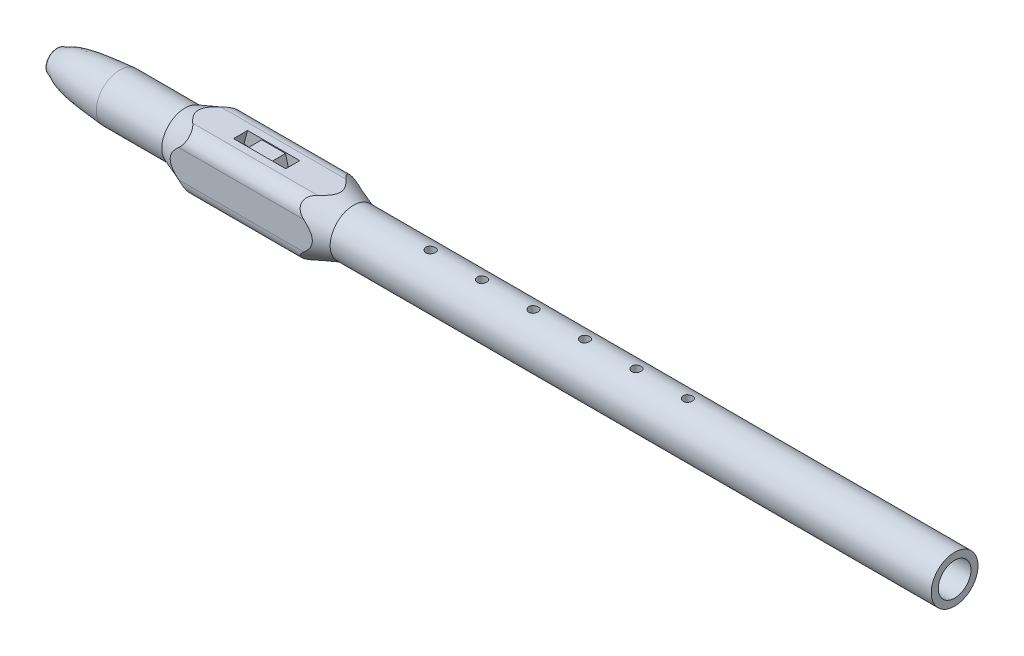
from build123d import *

# Parameters (mm, degrees)
SKETCH1_W           = 38.1
SKETCH1_H           = 38.1
BOSS_EXTRUDE1_DEPTH = 304.8
SKETCH2_W           = 457.2
SKETCH2_H           = 11.1125
SKETCH4_R           = 3.175
CUT_EXTRUDE1_DEPTH  = 50.8
FILLET1_R           = 1.27
SKETCH5_R           = 3.175
CUT_EXTRUDE2_DEPTH  = 306.988308712
CUT_EXTRUDE4_DEPTH  = 4.7625
SKETCH8_W           = 19.528086639
SKETCH8_H           = 9.525
CUT_EXTRUDE5_DEPTH  = 0.635
FILLET2_R           = 9.525


with BuildPart() as part:
    # Sketch1 → Boss-Extrude1 (new, symmetric)
    with BuildSketch(Plane(origin=(0, 0, 0), x_dir=(0, 0, -1), z_dir=(1, 0, 0))):
        Rectangle(SKETCH1_W, SKETCH1_H)
    extrude(amount=BOSS_EXTRUDE1_DEPTH, both=True)

    # Sketch2 → Cut-Revolve1 (revolve, cut)
    with BuildSketch(Plane(origin=(0, 0, 0), x_dir=(1, 0, 0), z_dir=(0, 1, 0))):
        with Locations((76.2, -5.55625)):
            Rectangle(SKETCH2_W, SKETCH2_H)
        with BuildLine():
            Line((-171.45, 0), (-273.05, 0))
            ThreePointArc((-273.05, 0), (-269.795224106, -7.857724106), (-261.9375, -11.1125))
            Line((-261.9375, -11.1125), (-182.5625, -11.1125))
            ThreePointArc((-182.5625, -11.1125), (-174.704775894, -7.857724106), (-171.45, 0))
        make_face()
    revolve(axis=Axis((-304.8, 0, 0), (1, 0, 0)), mode=Mode.SUBTRACT)

    # Sketch3 → Cut-Revolve2 (revolve, cut)
    with BuildSketch(Plane.XY, mode=Mode.PRIVATE) as cut_revolve2_sk:
        with BuildLine():
            Line((304.8, 19.05), (304.8, 15.875))
            Line((304.8, 15.875), (-103.1875, 15.875))
            add(Edge.make_bspline(
                [(-103.1875, 15.875), (-131.457422614, 25.417723514), (-160.3375, 42.016250259)],
                knots=[0, 0, 0, 0.605944762, 0.605944762, 0.605944762], degree=2))
            add(Edge.make_bspline(
                [(-217.4875, 15.875), (-189.217577386, 25.417723514), (-160.3375, 42.016250259)],
                knots=[0, 0, 0, 0.605944762, 0.605944762, 0.605944762], degree=2))
            Line((-217.4875, 15.875), (-261.9375, 15.875))
            add(Edge.make_bspline(
                [(-261.9375, 15.875), (-299.478479185, 13.267926709), (-300.391996549, 9.252287069), (-299.320045063, 8.700258168), (-304.8, 7.62)],
                knots=[0, 0, 0, 0, 0, 1, 1, 1, 1, 1], degree=4))
            Line((-304.8, 7.62), (-304.8, 19.05))
            Line((-304.8, 19.05), (-304.8, 56.377941574))
            Line((-304.8, 56.377941574), (304.8, 56.377941574))
            Line((304.8, 56.377941574), (304.8, 19.05))
        make_face()
    revolve(cut_revolve2_sk.sketch.rotate(Axis((-304.8, 0, 0), (1, 0, 0)), 180), axis=Axis((-304.8, 0, 0), (1, 0, 0)), mode=Mode.SUBTRACT)

    # Sketch4 → Cut-Extrude1 (cut)
    with BuildSketch(Plane.ZY.offset(304.8)):
        Circle(SKETCH4_R)
    extrude(amount=-CUT_EXTRUDE1_DEPTH, mode=Mode.SUBTRACT)

    # Fillet1
    fillet1_edges = [part.edges().sort_by_distance(p)[0] for p in [
        (-304.8, 7.62, 0),
    ]]
    fillet(fillet1_edges, radius=FILLET1_R)

    # Sketch5 → Cut-Extrude2 (cut, through all)
    with BuildSketch(Plane(origin=(0, 0, 0), x_dir=(1, 0, 0), z_dir=(0, 1, 0))):
        with Locations(Location((-50.8, 0, 0), (0, 0, 90))):
            Circle(SKETCH5_R)
        with Locations(Location((-15.875, 0, 0), (0, 0, 90))):
            Circle(SKETCH5_R)
        with Locations(Location((19.05, 0, 0), (0, 0, 90))):
            Circle(SKETCH5_R)
        with Locations(Location((53.975, 0, 0), (0, 0, 90))):
            Circle(SKETCH5_R)
        with Locations(Location((88.9, 0, 0), (0, 0, 90))):
            Circle(SKETCH5_R)
        with Locations(Location((123.825, 0, 0), (0, 0, 90))):
            Circle(SKETCH5_R)
    extrude(amount=CUT_EXTRUDE2_DEPTH, mode=Mode.SUBTRACT)

    # Sketch7 → Cut-Extrude4 (cut, symmetric)
    with BuildSketch(Plane.XY):
        Polygon((-177.77754171, 26.86882557), (-184.427590717, 2.050504802), (-175.227147222, -0.414746603), (-168.577098214, 24.403574166), align=None)
        Polygon((-146.514298715, 26.86882557), (-155.714742211, 24.403574166), (-149.064693203, -0.414746603), (-139.864249708, 2.050504802), align=None)
    extrude(amount=CUT_EXTRUDE4_DEPTH, both=True, mode=Mode.SUBTRACT)

    # Sketch8 → Cut-Extrude5 (cut)
    with BuildSketch(Plane(origin=(0, 19.05, 0), x_dir=(1, 0, 0), z_dir=(0, 1, 0))):
        with Locations((-162.961998978, 0)):
            Rectangle(SKETCH8_W, SKETCH8_H)
    extrude(amount=-CUT_EXTRUDE5_DEPTH, mode=Mode.SUBTRACT)

    # Fillet2
    fillet2_edges = [part.edges().sort_by_distance(p)[0] for p in [
        (-160.3375, -19.05, -19.05),
        (-160.3375, -19.05, 19.05),
        (-160.3375, 19.05, -19.05),
        (-160.3375, 19.05, 19.05),
    ]]
    fillet(fillet2_edges, radius=FILLET2_R)


solid = part.part
